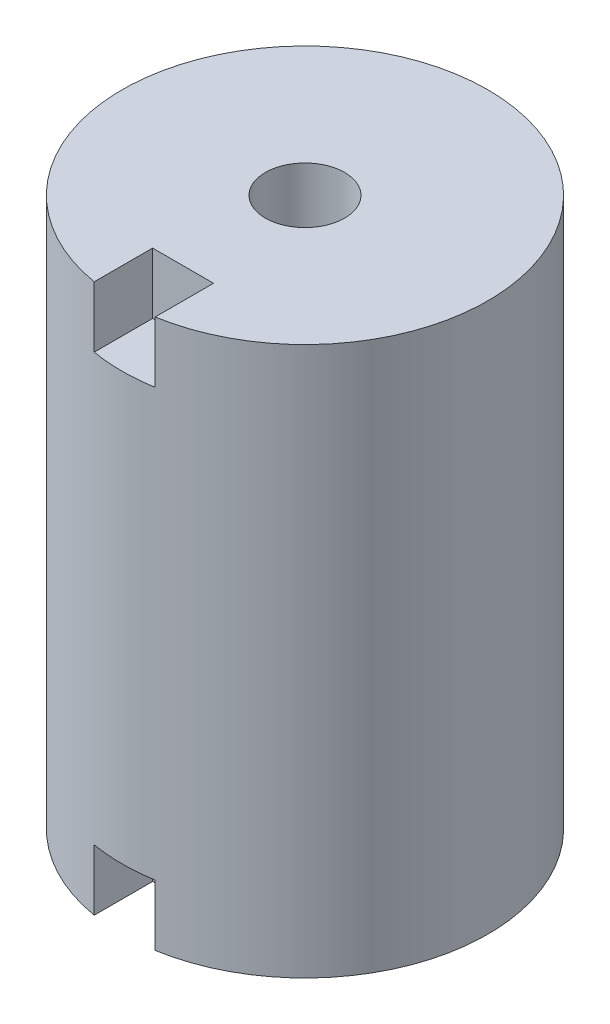
from build123d import *

# Parameters (mm, degrees)
ESBO_O2_R                = 6
ESBO_O2_R_2              = 1.3
RESSALTO_EXTRUS_O1_DEPTH = 9
CORTE_EXTRUS_O1_DEPTH    = 6
ESBO_O4_W                = 2
ESBO_O4_H                = 3
CORTE_EXTRUS_O2_DEPTH    = 2


with BuildPart() as part:
    # Esboço2 → Ressalto-extrusão1 (new, symmetric)
    with BuildSketch(Plane(origin=(0, 0, 0), x_dir=(1, 0, 0), z_dir=(0, 1, 0))):
        with Locations(Location((0, 0, 0), (0, 0, 270))):
            Circle(ESBO_O2_R)
        with Locations(Location((0, 0, 0), (0, 0, 270))):
            Circle(ESBO_O2_R_2, mode=Mode.SUBTRACT)
    extrude(amount=RESSALTO_EXTRUS_O1_DEPTH, both=True)

    # Esboço3 → Corte-extrusão1 (cut)
    with BuildSketch(Plane.XZ.offset(9)):
        with BuildLine():
            Line((-3.105237511, 2.6), (3.105237511, 2.6))
            ThreePointArc((3.105237511, 2.6), (0, -4.05), (-3.105237511, 2.6))
        make_face()
    extrude(amount=-CORTE_EXTRUS_O1_DEPTH, mode=Mode.SUBTRACT)

    # Esboço4 → Corte-extrusão2 (cut)
    with BuildSketch(Plane(origin=(0, 9, 0), x_dir=(1, 0, 0), z_dir=(0, 1, 0))):
        with Locations((0, -5.5)):
            Rectangle(ESBO_O4_W, ESBO_O4_H)
    corte_extrus_o2 = extrude(amount=-CORTE_EXTRUS_O2_DEPTH, mode=Mode.SUBTRACT)

    # Espelhar1: Corte-extrusão2 across plane
    add(corte_extrus_o2.mirror(Plane.ZX), mode=Mode.SUBTRACT)


solid = part.part
